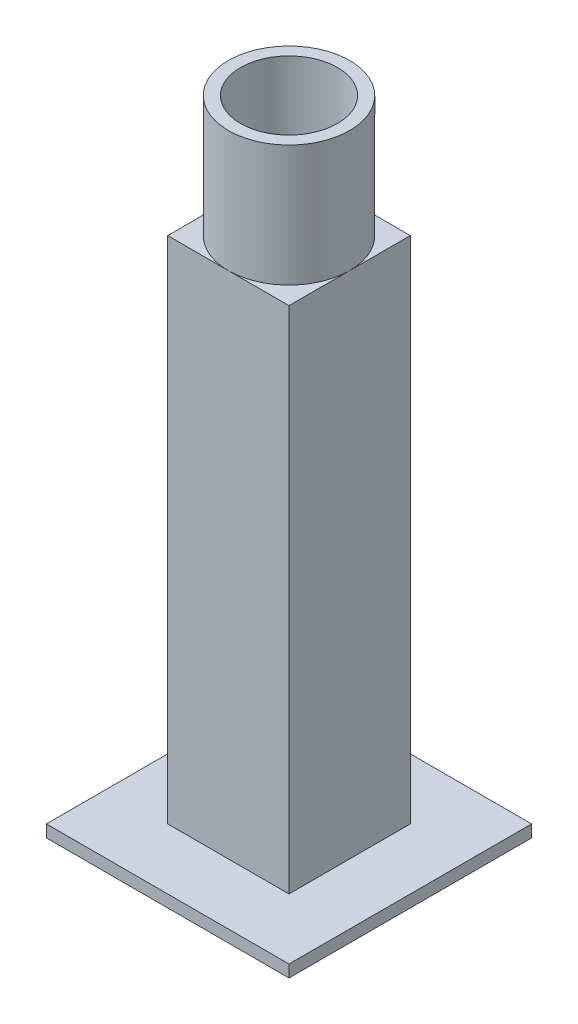
from build123d import *

# Parameters (mm, degrees)
SKETCH1_W           = 200
SKETCH1_H           = 200
BOSS_EXTRUDE1_DEPTH = 10
SKETCH2_W           = 100
SKETCH2_H           = 100
BOSS_EXTRUDE2_DEPTH = 420
SKETCH3_R           = 40
CUT_EXTRUDE1_DEPTH  = 420
BOSS_EXTRUDE4_START = 100
SKETCH5_R           = 50
SKETCH5_R_2         = 40
BOSS_EXTRUDE4_DEPTH = 100


with BuildPart() as part:
    # Sketch1 → Boss-Extrude1 (new body)
    with BuildSketch(Plane(origin=(0, 0, 0), x_dir=(1, 0, 0), z_dir=(0, 1, 0))):
        with Locations((100, 100)):
            Rectangle(SKETCH1_W, SKETCH1_H)
    extrude(amount=BOSS_EXTRUDE1_DEPTH)

    # Sketch2 → Boss-Extrude2 (add)
    with BuildSketch(Plane(origin=(0, 10, 0), x_dir=(1, 0, 0), z_dir=(0, 1, 0))):
        with Locations((100, 100)):
            Rectangle(SKETCH2_W, SKETCH2_H)
    extrude(amount=BOSS_EXTRUDE2_DEPTH)

    # Sketch3 → Cut-Extrude1 (cut)
    with BuildSketch(Plane(origin=(0, 430, 0), x_dir=(1, 0, 0), z_dir=(0, 1, 0))):
        with Locations(Location((100, 100, 0), (0, 0, 270))):
            Circle(SKETCH3_R)
    extrude(amount=-CUT_EXTRUDE1_DEPTH, mode=Mode.SUBTRACT)

    # Sketch5 → Boss-Extrude4 (add)
    with BuildSketch(Plane(origin=(0, 430, 0), x_dir=(1, 0, 0), z_dir=(0, 1, 0)).offset(BOSS_EXTRUDE4_START)):
        with Locations(Location((100, 100, 0), (0, 0, 270))):
            Circle(SKETCH5_R)
        with Locations(Location((100, 100, 0), (0, 0, 270))):
            Circle(SKETCH5_R_2, mode=Mode.SUBTRACT)
    extrude(amount=-BOSS_EXTRUDE4_DEPTH)


solid = part.part
